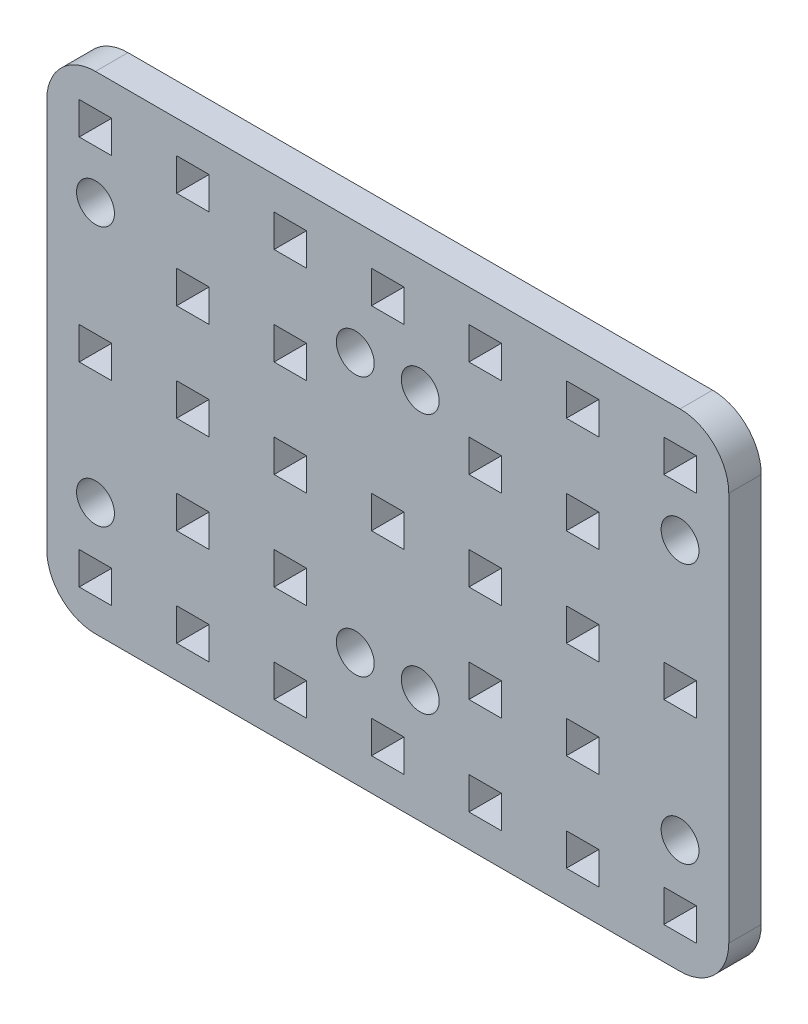
from build123d import *

# Parameters (mm, degrees)
MODEL_R                 = 1.75
MODEL_W                 = 3
MODEL_H                 = 3
MODEL_W_2               = 3.000000001
SALIENTE_EXTRUIR1_DEPTH = 3


with BuildPart() as part:
    # Model → Saliente-Extruir1 (new body)
    with BuildSketch(Plane.XY):
        with BuildLine():
            Line((10.922877124, 294.963401588), (64.922877125, 294.963401588))
            ThreePointArc((64.922877125, 294.963401588), (68.10485764, 293.645382103), (69.422877125, 290.463401588))
            Line((69.422877125, 290.463401588), (69.422877125, 254.463401588))
            ThreePointArc((69.422877125, 254.463401588), (68.10485764, 251.281421073), (64.922877125, 249.963401588))
            Line((64.922877125, 249.963401588), (10.922877124, 249.963401588))
            ThreePointArc((10.922877124, 249.963401588), (7.740896609, 251.281421073), (6.422877125, 254.463401588))
            Line((6.422877125, 254.463401588), (6.422877125, 290.463401588))
            ThreePointArc((6.422877125, 290.463401588), (7.740896609, 293.645382103), (10.922877124, 294.963401588))
        make_face()
        with Locations((64.922877125, 284.463401588)):
            Circle(MODEL_R, mode=Mode.SUBTRACT)
        with Locations((34.922877124, 284.463401588)):
            Circle(MODEL_R, mode=Mode.SUBTRACT)
        with Locations((64.922877125, 260.463401588)):
            Circle(MODEL_R, mode=Mode.SUBTRACT)
        with Locations((34.922877124, 260.463401588)):
            Circle(MODEL_R, mode=Mode.SUBTRACT)
        with Locations((40.922877124, 284.463401588)):
            Circle(MODEL_R, mode=Mode.SUBTRACT)
        with Locations((10.922877124, 284.463401588)):
            Circle(MODEL_R, mode=Mode.SUBTRACT)
        with Locations((40.922877124, 260.463401588)):
            Circle(MODEL_R, mode=Mode.SUBTRACT)
        with Locations((10.922877124, 260.463401588)):
            Circle(MODEL_R, mode=Mode.SUBTRACT)
        with Locations((10.922877124, 290.463401588)):
            Rectangle(MODEL_W, MODEL_H, mode=Mode.SUBTRACT)
        with Locations((19.922877124, 290.463401588)):
            Rectangle(MODEL_W, MODEL_H, mode=Mode.SUBTRACT)
        with Locations((28.922877124, 290.463401588)):
            Rectangle(MODEL_W, MODEL_H, mode=Mode.SUBTRACT)
        with Locations((55.922877124, 290.463401588)):
            Rectangle(MODEL_W, MODEL_H, mode=Mode.SUBTRACT)
        with Locations((64.922877125, 290.463401588)):
            Rectangle(MODEL_W_2, MODEL_H, mode=Mode.SUBTRACT)
        with Locations((10.922877124, 254.463401588)):
            Rectangle(MODEL_W, MODEL_H, mode=Mode.SUBTRACT)
        with Locations((19.922877124, 254.463401588)):
            Rectangle(MODEL_W, MODEL_H, mode=Mode.SUBTRACT)
        with Locations((28.922877124, 254.463401588)):
            Rectangle(MODEL_W, MODEL_H, mode=Mode.SUBTRACT)
        with Locations((55.922877124, 254.463401588)):
            Rectangle(MODEL_W, MODEL_H, mode=Mode.SUBTRACT)
        with Locations((64.922877125, 254.463401588)):
            Rectangle(MODEL_W_2, MODEL_H, mode=Mode.SUBTRACT)
        with Locations((19.922877124, 263.463401588)):
            Rectangle(MODEL_W, MODEL_H, mode=Mode.SUBTRACT)
        with Locations((28.922877124, 263.463401588)):
            Rectangle(MODEL_W, MODEL_H, mode=Mode.SUBTRACT)
        with Locations((55.922877124, 263.463401588)):
            Rectangle(MODEL_W, MODEL_H, mode=Mode.SUBTRACT)
        with Locations((37.922877124, 290.463401588)):
            Rectangle(MODEL_W, MODEL_H, mode=Mode.SUBTRACT)
        with Locations((46.922877124, 290.463401588)):
            Rectangle(MODEL_W, MODEL_H, mode=Mode.SUBTRACT)
        with Locations((37.922877124, 254.463401588)):
            Rectangle(MODEL_W, MODEL_H, mode=Mode.SUBTRACT)
        with Locations((46.922877124, 254.463401588)):
            Rectangle(MODEL_W, MODEL_H, mode=Mode.SUBTRACT)
        with Locations((46.922877124, 263.463401588)):
            Rectangle(MODEL_W, MODEL_H, mode=Mode.SUBTRACT)
        with Locations((10.922877124, 272.463401588)):
            Rectangle(MODEL_W, MODEL_H, mode=Mode.SUBTRACT)
        with Locations((19.922877124, 272.463401588)):
            Rectangle(MODEL_W, MODEL_H, mode=Mode.SUBTRACT)
        with Locations((28.922877124, 272.463401588)):
            Rectangle(MODEL_W, MODEL_H, mode=Mode.SUBTRACT)
        with Locations((55.922877124, 272.463401588)):
            Rectangle(MODEL_W, MODEL_H, mode=Mode.SUBTRACT)
        with Locations((64.922877125, 272.463401588)):
            Rectangle(MODEL_W_2, MODEL_H, mode=Mode.SUBTRACT)
        with Locations((19.922877124, 281.463401588)):
            Rectangle(MODEL_W, MODEL_H, mode=Mode.SUBTRACT)
        with Locations((28.922877124, 281.463401588)):
            Rectangle(MODEL_W, MODEL_H, mode=Mode.SUBTRACT)
        with Locations((55.922877124, 281.463401588)):
            Rectangle(MODEL_W, MODEL_H, mode=Mode.SUBTRACT)
        with Locations((37.922877124, 272.463401588)):
            Rectangle(MODEL_W, MODEL_H, mode=Mode.SUBTRACT)
        with Locations((46.922877124, 272.463401588)):
            Rectangle(MODEL_W, MODEL_H, mode=Mode.SUBTRACT)
        with Locations((46.922877124, 281.463401588)):
            Rectangle(MODEL_W, MODEL_H, mode=Mode.SUBTRACT)
    extrude(amount=SALIENTE_EXTRUIR1_DEPTH)


solid = part.part
